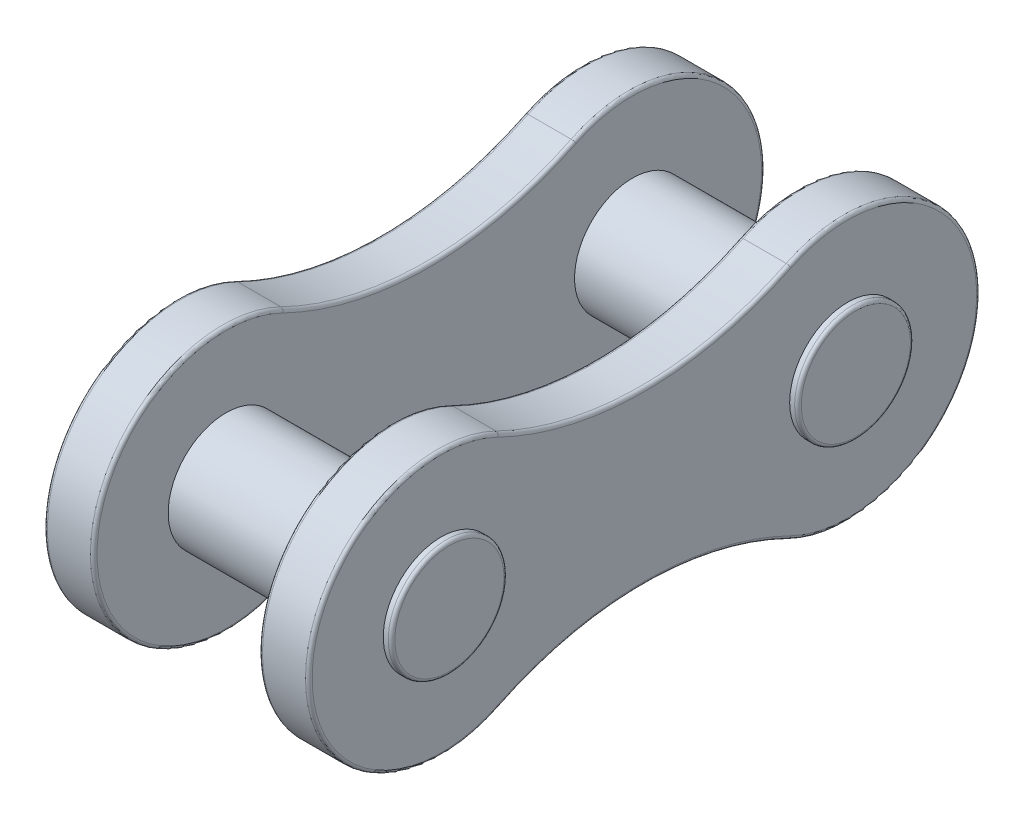
from build123d import *

# Parameters (mm, degrees)
BOSS_EXTRUDE1_START = 2.5
SKETCH1_R           = 1.75
BOSS_EXTRUDE1_DEPTH = 1.5
BOSS_EXTRUDE2_START = -2.5
SKETCH2_R           = 1.75
BOSS_EXTRUDE2_DEPTH = 1.5
SKETCH3_R           = 1.75
BOSS_EXTRUDE3_DEPTH = 4.25
FILLET1_R           = 0.1


with BuildPart() as part:
    # Sketch1 → Boss-Extrude1 (new body)
    with BuildSketch(Plane(origin=(0, 0, 0), x_dir=(0, 0, -1), z_dir=(1, 0, 0)).offset(BOSS_EXTRUDE1_START)):
        with BuildLine():
            ThreePointArc((-4.386164856, 3.594697381), (-10.140630798, 0), (-4.386164856, -3.594697381))
            ThreePointArc((-4.386164856, -3.594697381), (0, -2.581440832), (4.386164856, -3.594697381))
            ThreePointArc((4.386164856, -3.594697381), (10.140630798, 0), (4.386164856, 3.594697381))
            ThreePointArc((4.386164856, 3.594697381), (0, 2.581440832), (-4.386164856, 3.594697381))
        make_face()
        with Locations((-6.140630798, 0)):
            Circle(SKETCH1_R, mode=Mode.SUBTRACT)
        with Locations(Location((6.140630798, 0, 0), (0, 0, 180))):
            Circle(SKETCH1_R, mode=Mode.SUBTRACT)
    extrude(amount=BOSS_EXTRUDE1_DEPTH)



with BuildPart() as body_2:
    # Sketch2 → Boss-Extrude2 (new body)
    with BuildSketch(Plane(origin=(0, 0, 0), x_dir=(0, 0, -1), z_dir=(1, 0, 0)).offset(BOSS_EXTRUDE2_START)):
        with BuildLine():
            ThreePointArc((-4.386164856, 3.594697381), (0, 2.581440832), (4.386164856, 3.594697381))
            ThreePointArc((4.386164856, 3.594697381), (10.140630798, 0), (4.386164856, -3.594697381))
            ThreePointArc((4.386164856, -3.594697381), (0, -2.581440832), (-4.386164856, -3.594697381))
            ThreePointArc((-4.386164856, -3.594697381), (-10.140630798, 0), (-4.386164856, 3.594697381))
        make_face()
        with Locations(Location((6.140630798, 0, 0), (0, 0, 180))):
            Circle(SKETCH2_R, mode=Mode.SUBTRACT)
        with Locations((-6.140630798, 0)):
            Circle(SKETCH2_R, mode=Mode.SUBTRACT)
    extrude(amount=-BOSS_EXTRUDE2_DEPTH)


with BuildPart() as part_1:
    add(part.part)

    add(body_2.part)  # Boss-Extrude3 merges body 2
    # Sketch3 → Boss-Extrude3 (add, symmetric)
    with BuildSketch(Plane(origin=(0, 0, 0), x_dir=(0, 0, -1), z_dir=(1, 0, 0))):
        with Locations((6.140630798, 0)):
            Circle(SKETCH3_R)
        with Locations((-6.140630798, 0)):
            Circle(SKETCH3_R)
    extrude(amount=BOSS_EXTRUDE3_DEPTH, both=True)

    # Fillet1
    fillet1_edges = [part_1.edges().sort_by_distance(p)[0] for p in [
        (4, -2.581440832, 0),
        (4, 0, -10.140630798),
        (-4.25, 0, -4.390630798),
        (4.25, 0, -4.390630798),
        (-4, 0, 10.140630798),
        (-4, 2.581440832, 0),
        (-4, 0, -10.140630798),
        (-4, -2.581440832, 0),
        (-2.5, 0, 10.140630798),
        (-2.5, -2.581440832, 0),
        (-2.5, 0, -10.140630798),
        (-2.5, 2.581440832, 0),
        (-4.25, 0, 7.890630798),
        (4.25, 0, 7.890630798),
        (4, 2.581440832, 0),
        (2.5, 0, -10.140630798),
        (2.5, -2.581440832, 0),
        (2.5, 0, 10.140630798),
        (2.5, 2.581440832, 0),
        (4, 0, 10.140630798),
    ]]
    fillet(fillet1_edges, radius=FILLET1_R)


solid = part_1.part
